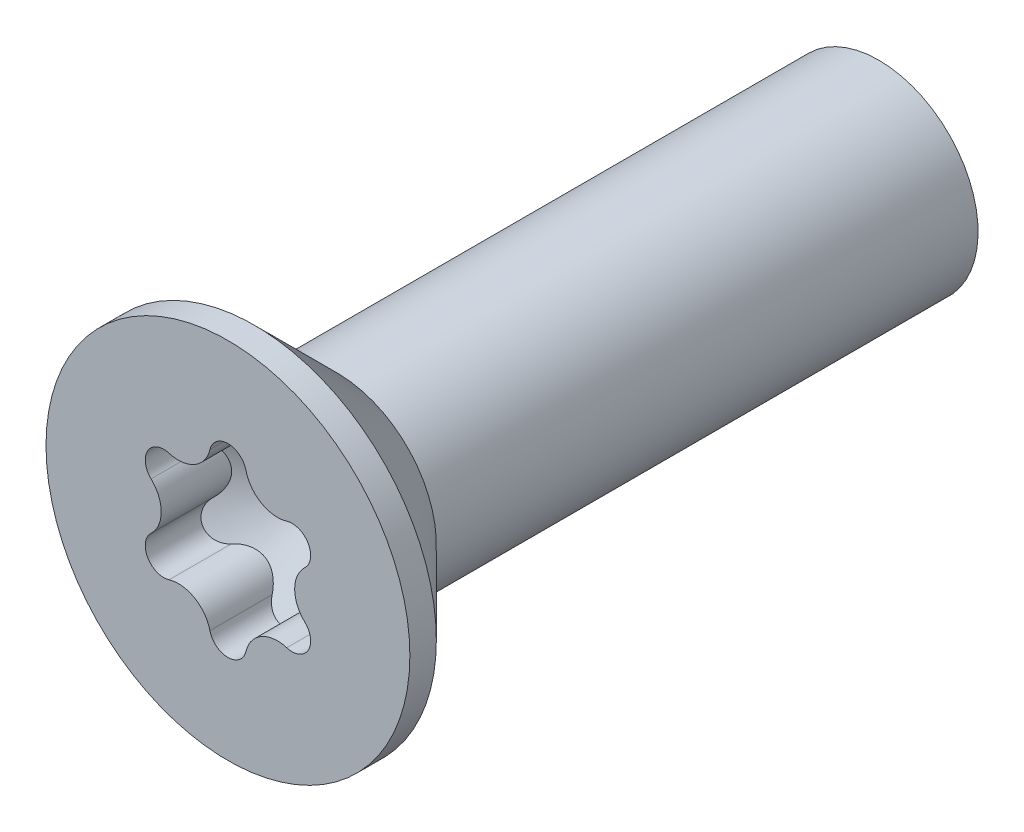
from build123d import *

# Parameters (mm, degrees)
HEXALOBULAR_REACH = 12.73


with BuildPart() as part:
    # BodySke → Base-Revolve (revolve)
    with BuildSketch(Plane(origin=(0, 0, 0), x_dir=(0, 0, -1), z_dir=(1, 0, 0)), mode=Mode.PRIVATE) as base_revolve_sk:
        Polygon((0, 0), (0, 2.75), (0.4, 2.75), (1.65, 1.5), (10, 1.5), (10, 0), align=None)
    revolve(base_revolve_sk.sketch.rotate(Axis((0, 0, 0), (0, 0, 1)), 90), axis=Axis((0, 0, 0), (0, 0, 1)))

    # PreBSke → PreBroach (revolve, cut)
    with BuildSketch(Plane(origin=(0, 0, 0), x_dir=(0, 0, -1), z_dir=(1, 0, 0)), mode=Mode.PRIVATE) as prebroach_sk:
        Polygon((0, 0), (0, 1.4), (0.83, 1.4), (1.671204867, 0), align=None)
    revolve(prebroach_sk.sketch.rotate(Axis((0, 0, 0), (0, 0, 1)), 90), axis=Axis((0, 0, 0), (0, 0, 1)), mode=Mode.SUBTRACT)

    # Hexalobular: up to this cone (the profile starts inside it)
    hexalobular_end = Plane(origin=(0, 0, 0), z_dir=(0, 0, 1)).offset(-1.671203867) * Cone(1.664e-06, 29.428716539, 17.682555837, align=(Align.CENTER, Align.CENTER, Align.MIN), mode=Mode.PRIVATE)
    # HexSke → Hexalobular (add, up to the surface)
    with BuildSketch(Plane.XY, mode=Mode.PRIVATE) as hexalobular_sk1:
        with BuildLine():
            ThreePointArc((-1.212435565, -0.7), (-1.246995094, -0.519439448), (-1.162126056, -0.356363636))
            ThreePointArc((-1.162126056, -0.356363636), (-1.008436863, 0), (-1.162126056, 0.356363636))
            ThreePointArc((-1.162126056, 0.356363636), (-1.246995094, 0.519439448), (-1.212435565, 0.7))
            ThreePointArc((-1.212435565, 0.7), (-1.4, 0), (-1.212435565, -0.7))
        make_face()
    hexalobular_tool1 = extrude(hexalobular_sk1.sketch, amount=-HEXALOBULAR_REACH, mode=Mode.PRIVATE) & hexalobular_end
    add(hexalobular_tool1.solids().sort_by_distance((-1.225792, 0, 0))[0])
    # HexSke → Hexalobular (add, up to the surface)
    with BuildSketch(Plane.XY, mode=Mode.PRIVATE) as hexalobular_sk2:
        with BuildLine():
            ThreePointArc((0, 1.4), (-0.7, 1.212435565), (-1.212435565, 0.7))
            ThreePointArc((-1.212435565, 0.7), (-1.073345305, 0.820209706), (-0.88968299, 0.828248869))
            ThreePointArc((-0.88968299, 0.828248869), (-0.504218431, 0.873331941), (-0.272443066, 1.184612505))
            ThreePointArc((-0.272443066, 1.184612505), (-0.173649789, 1.339649154), (0, 1.4))
        make_face()
    hexalobular_tool2 = extrude(hexalobular_sk2.sketch, amount=-HEXALOBULAR_REACH, mode=Mode.PRIVATE) & hexalobular_end
    add(hexalobular_tool2.solids().sort_by_distance((-0.612896, 1.061567, 0))[0])
    # HexSke → Hexalobular (add, up to the surface)
    with BuildSketch(Plane.XY, mode=Mode.PRIVATE) as hexalobular_sk3:
        with BuildLine():
            ThreePointArc((1.212435565, 0.7), (0.7, 1.212435565), (0, 1.4))
            ThreePointArc((0, 1.4), (0.173649789, 1.339649154), (0.272443066, 1.184612505))
            ThreePointArc((0.272443066, 1.184612505), (0.504218431, 0.873331941), (0.88968299, 0.828248869))
            ThreePointArc((0.88968299, 0.828248869), (1.073345305, 0.820209706), (1.212435565, 0.7))
        make_face()
    hexalobular_tool3 = extrude(hexalobular_sk3.sketch, amount=-HEXALOBULAR_REACH, mode=Mode.PRIVATE) & hexalobular_end
    add(hexalobular_tool3.solids().sort_by_distance((0.612896, 1.061567, 0))[0])
    # HexSke → Hexalobular (add, up to the surface)
    with BuildSketch(Plane.XY, mode=Mode.PRIVATE) as hexalobular_sk4:
        with BuildLine():
            ThreePointArc((1.162126056, -0.356363636), (1.246995094, -0.519439448), (1.212435565, -0.7))
            ThreePointArc((1.212435565, -0.7), (1.352296157, -0.362346663), (1.4, 0))
            ThreePointArc((1.4, 0), (1.352296157, 0.362346663), (1.212435565, 0.7))
            ThreePointArc((1.212435565, 0.7), (1.246995094, 0.519439448), (1.162126056, 0.356363636))
            ThreePointArc((1.162126056, 0.356363636), (1.008436863, 0), (1.162126056, -0.356363636))
        make_face()
    hexalobular_tool4 = extrude(hexalobular_sk4.sketch, amount=-HEXALOBULAR_REACH, mode=Mode.PRIVATE) & hexalobular_end
    add(hexalobular_tool4.solids().sort_by_distance((1.225792, 0, 0))[0])
    # HexSke → Hexalobular (add, up to the surface)
    with BuildSketch(Plane.XY, mode=Mode.PRIVATE) as hexalobular_sk5:
        with BuildLine():
            ThreePointArc((0.272443066, -1.184612505), (0.173649789, -1.339649154), (0, -1.4))
            ThreePointArc((0, -1.4), (0.7, -1.212435565), (1.212435565, -0.7))
            ThreePointArc((1.212435565, -0.7), (1.073345305, -0.820209706), (0.88968299, -0.828248869))
            ThreePointArc((0.88968299, -0.828248869), (0.504218431, -0.873331941), (0.272443066, -1.184612505))
        make_face()
    hexalobular_tool5 = extrude(hexalobular_sk5.sketch, amount=-HEXALOBULAR_REACH, mode=Mode.PRIVATE) & hexalobular_end
    add(hexalobular_tool5.solids().sort_by_distance((0.612896, -1.061567, 0))[0])
    # HexSke → Hexalobular (add, up to the surface)
    with BuildSketch(Plane.XY, mode=Mode.PRIVATE) as hexalobular_sk6:
        with BuildLine():
            ThreePointArc((-0.88968299, -0.828248869), (-1.073345305, -0.820209706), (-1.212435565, -0.7))
            ThreePointArc((-1.212435565, -0.7), (-0.7, -1.212435565), (0, -1.4))
            ThreePointArc((0, -1.4), (-0.173649789, -1.339649154), (-0.272443066, -1.184612505))
            ThreePointArc((-0.272443066, -1.184612505), (-0.504218431, -0.873331941), (-0.88968299, -0.828248869))
        make_face()
    hexalobular_tool6 = extrude(hexalobular_sk6.sketch, amount=-HEXALOBULAR_REACH, mode=Mode.PRIVATE) & hexalobular_end
    add(hexalobular_tool6.solids().sort_by_distance((-0.612896, -1.061567, 0))[0])

    # ThdSchSke → ThreadSchematic (revolve, cut)
    with BuildSketch(Plane(origin=(0, 0, 0), x_dir=(0, 0, -1), z_dir=(1, 0, 0))):
        Polygon((10.161946751, 1.5), (10, 1.2195), (9.838053249, 1.5), align=None)
    revolve(axis=Axis((0, 0, 0), (0, 0, 1)), mode=Mode.SUBTRACT)


solid = part.part
